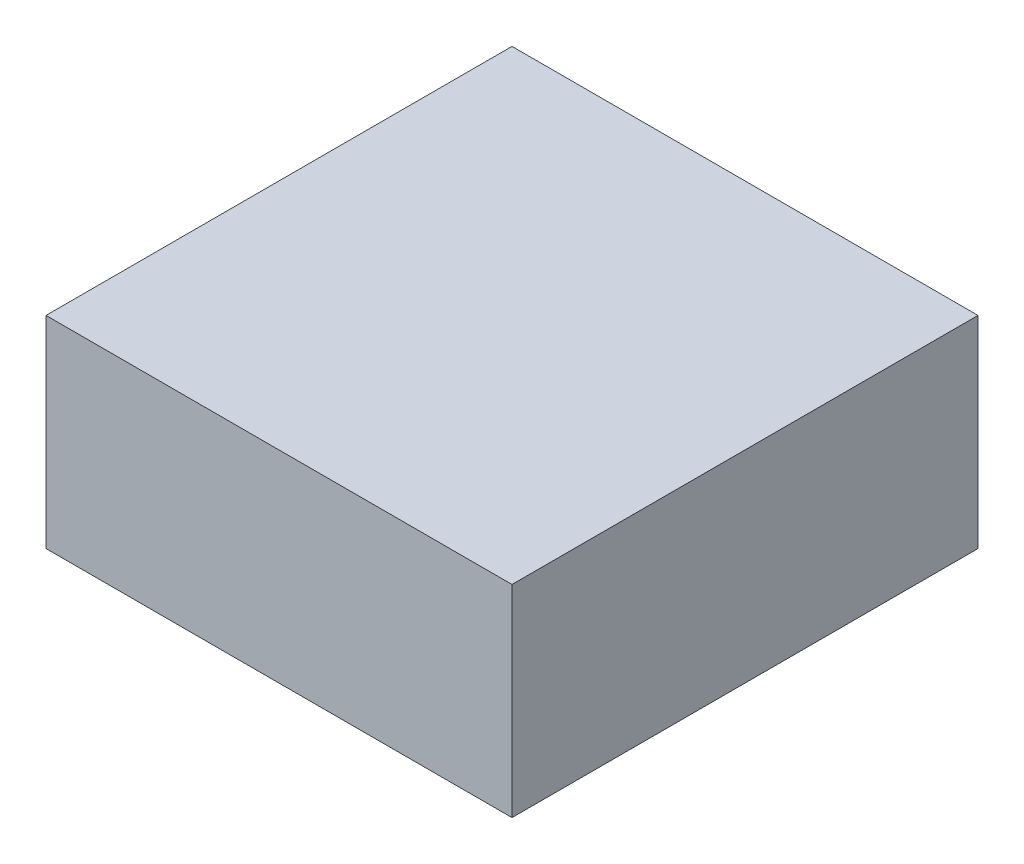
from build123d import *

# Parameters (mm, degrees)
SKETCH1_W           = 19.05
SKETCH1_H           = 19.05
BOSS_EXTRUDE1_DEPTH = 8.255


with BuildPart() as part:
    # Sketch1 → Boss-Extrude1 (new body)
    with BuildSketch(Plane(origin=(0, 0, 0), x_dir=(1, 0, 0), z_dir=(0, 1, 0))):
        Rectangle(SKETCH1_W, SKETCH1_H)
    extrude(amount=BOSS_EXTRUDE1_DEPTH)


solid = part.part
